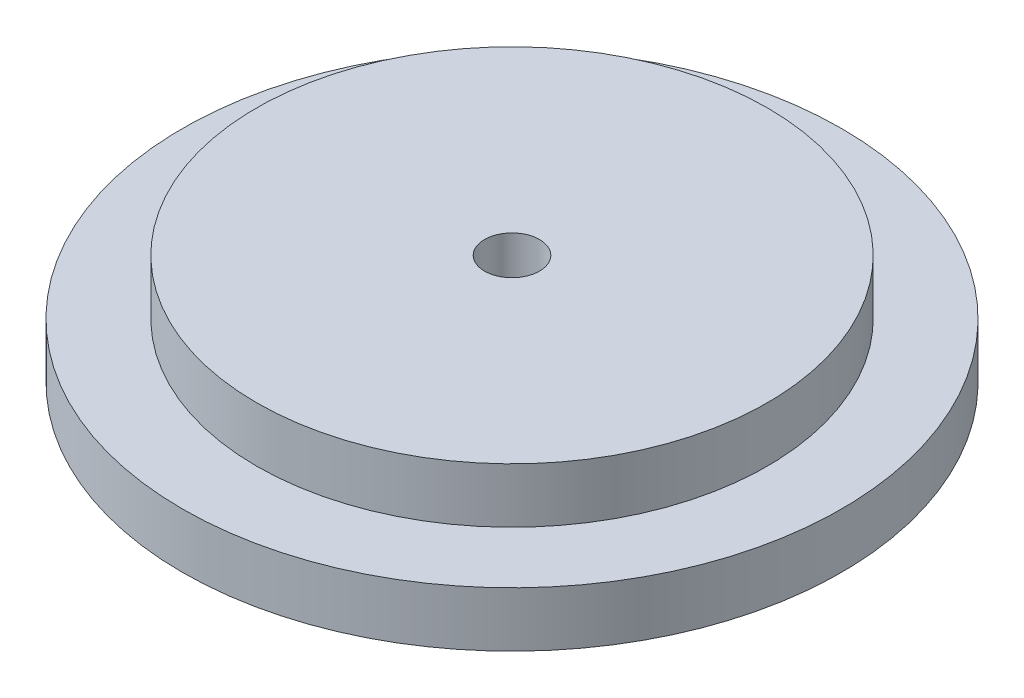
from build123d import *

# Parameters (mm, degrees)
ESQUISSE1_R             = 47.9
BOSS_EXTRU_1_DEPTH      = 10
ESQUISSE2_R             = 60
BOSS_EXTRU_2_DEPTH      = 10
ENL_V_START             = -10
ESQUISSE4_R             = 47.9
ESQUISSE4_R_2           = 46.5
ENL_V_MAT_EXTRU_1_DEPTH = 10
ESQUISSE5_R             = 5
ENL_V_MAT_EXTRU_2_DEPTH = 88.177978871


with BuildPart() as part:
    # Esquisse1 → Boss.-Extru.1 (new body)
    with BuildSketch(Plane(origin=(0, 0, 0), x_dir=(1, 0, 0), z_dir=(0, 1, 0))):
        with Locations(Location((0, 0, 0), (0, 0, 270))):
            Circle(ESQUISSE1_R)
    extrude(amount=BOSS_EXTRU_1_DEPTH)

    # Esquisse2 → Boss.-Extru.2 (add)
    with BuildSketch(Plane.XZ):
        with Locations(Location((0, 0, 0), (0, 0, 270))):
            Circle(ESQUISSE2_R)
    extrude(amount=BOSS_EXTRU_2_DEPTH)

    # Esquisse4 → Enlèv. mat.-Extru.1 (cut)
    with BuildSketch(Plane(origin=(0, 10, 0), x_dir=(1, 0, 0), z_dir=(0, 1, 0)).offset(ENL_V_START)):
        Circle(ESQUISSE4_R)
        with Locations(Location((0, 0, 0), (0, 0, 270))):
            Circle(ESQUISSE4_R_2, mode=Mode.SUBTRACT)
    extrude(amount=ENL_V_MAT_EXTRU_1_DEPTH, mode=Mode.SUBTRACT)

    # Esquisse5 → Enlèv. mat.-Extru.2 (cut, through all)
    with BuildSketch(Plane(origin=(0, 10, 0), x_dir=(1, 0, 0), z_dir=(0, 1, 0))):
        with Locations(Location((0, 0, 0), (0, 0, 270))):
            Circle(ESQUISSE5_R)
    extrude(amount=-ENL_V_MAT_EXTRU_2_DEPTH, mode=Mode.SUBTRACT)


solid = part.part
